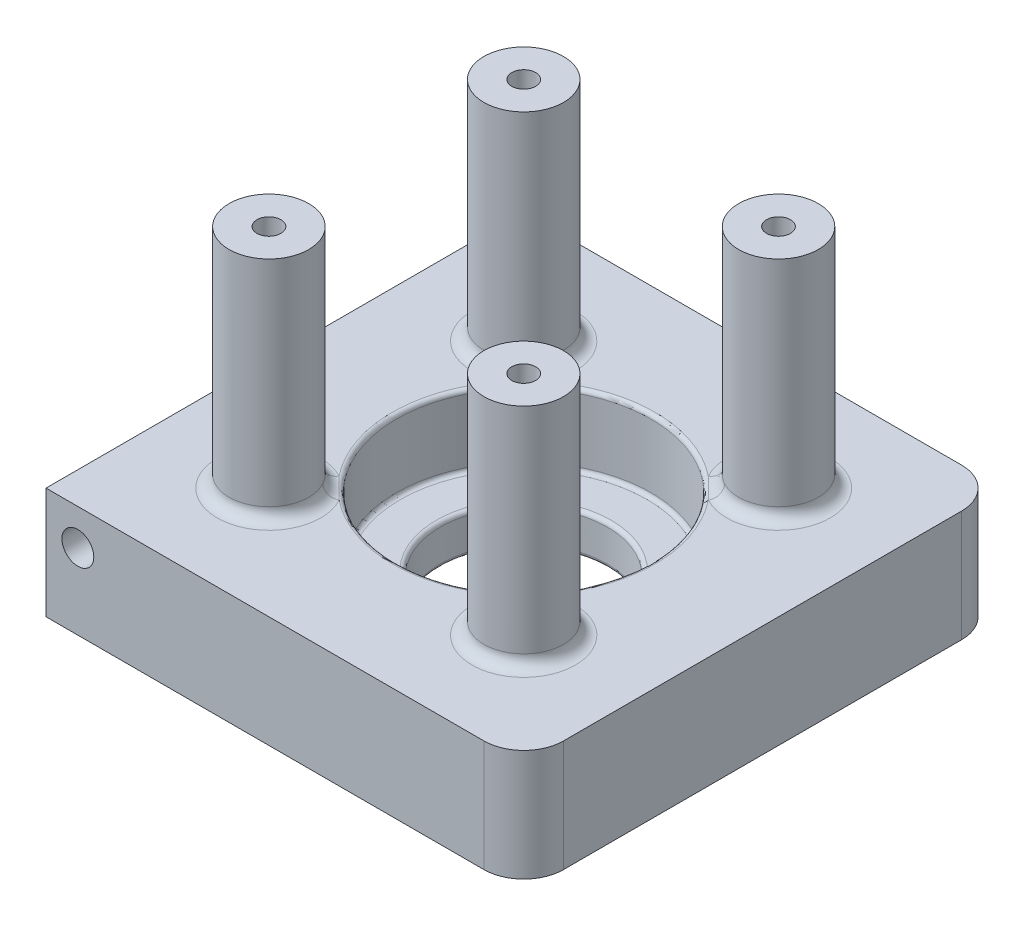
from build123d import *

# Parameters (mm, degrees)
SKETCH1_W           = 60
SKETCH1_H           = 60
BOSS_EXTRUDE1_DEPTH = 20
SKETCH2_R           = 7.5
CUT_EXTRUDE1_DEPTH  = 20
SKETCH3_R           = 16
CUT_EXTRUDE2_DEPTH  = 9
FILLET1_R           = 0.5
SKETCH4_W           = 50
SKETCH4_H           = 50
CUT_EXTRUDE3_DEPTH  = 6
SKETCH6_R           = 5
BOSS_EXTRUDE2_DEPTH = 28.45
SKETCH5_R           = 1.5
CUT_EXTRUDE5_DEPTH  = 54.45
SKETCH7_R           = 3
CUT_EXTRUDE6_DEPTH  = 3
FILLET2_R           = 1.5
SKETCH8_R           = 10.5
CUT_EXTRUDE7_DEPTH  = 9
FILLET3_R           = 0.5
SKETCH9_W           = 60
SKETCH9_H           = 60
SKETCH9_W_2         = 50
SKETCH9_H_2         = 50
CUT_EXTRUDE8_DEPTH  = 6
SKETCH10_R          = 2
CUT_EXTRUDE9_DEPTH  = 6
FILLET4_R           = 5
SKETCH11_R          = 2
CUT_EXTRUDE10_DEPTH = 14
CUT_EXTRUDE11_START = -14
SKETCH12_R          = 2
CUT_EXTRUDE11_DEPTH = 14


with BuildPart() as part:
    # Sketch1 → Boss-Extrude1 (new body)
    with BuildSketch(Plane(origin=(0, 0, 0), x_dir=(1, 0, 0), z_dir=(0, 1, 0))):
        Rectangle(SKETCH1_W, SKETCH1_H)
    extrude(amount=BOSS_EXTRUDE1_DEPTH)

    # Sketch2 → Cut-Extrude1 (cut)
    with BuildSketch(Plane(origin=(0, 20, 0), x_dir=(1, 0, 0), z_dir=(0, 1, 0))):
        with Locations(Location((0, 0, 0), (0, 0, 270))):
            Circle(SKETCH2_R)
    extrude(amount=-CUT_EXTRUDE1_DEPTH, mode=Mode.SUBTRACT)

    # Sketch3 → Cut-Extrude2 (cut)
    with BuildSketch(Plane(origin=(0, 20, 0), x_dir=(1, 0, 0), z_dir=(0, 1, 0))):
        with Locations(Location((0, 0, 0), (0, 0, 270))):
            Circle(SKETCH3_R)
    extrude(amount=-CUT_EXTRUDE2_DEPTH, mode=Mode.SUBTRACT)

    # Fillet1
    fillet1_edges = [part.edges().sort_by_distance(p)[0] for p in [
        (0, 0, -7.5),
        (0, 20, -16),
        (0, 11, -16),
        (0, 11, -7.5),
    ]]
    fillet(fillet1_edges, radius=FILLET1_R)

    # Sketch4 → Cut-Extrude3 (cut)
    with BuildSketch(Plane.XZ):
        Rectangle(SKETCH4_W, SKETCH4_H)
    extrude(amount=-CUT_EXTRUDE3_DEPTH, mode=Mode.SUBTRACT)

    # Sketch6 → Boss-Extrude2 (add)
    with BuildSketch(Plane(origin=(0, 20, 0), x_dir=(1, 0, 0), z_dir=(0, 1, 0))):
        with Locations(Location((-16, 16, 0), (0, 0, 270))):
            Circle(SKETCH6_R)
        with Locations(Location((16, 16, 0), (0, 0, 270))):
            Circle(SKETCH6_R)
        with Locations(Location((-16, -16, 0), (0, 0, 270))):
            Circle(SKETCH6_R)
        with Locations(Location((16, -16, 0), (0, 0, 270))):
            Circle(SKETCH6_R)
    extrude(amount=BOSS_EXTRUDE2_DEPTH)

    # Sketch5 → Cut-Extrude5 (cut)
    with BuildSketch(Plane.XZ.offset(-6)):
        with Locations(Location((-16, 16, 0), (0, 0, 270))):
            Circle(SKETCH5_R)
        with Locations(Location((-16, -16, 0), (0, 0, 270))):
            Circle(SKETCH5_R)
        with Locations(Location((16, -16, 0), (0, 0, 270))):
            Circle(SKETCH5_R)
        with Locations(Location((16, 16, 0), (0, 0, 270))):
            Circle(SKETCH5_R)
    extrude(amount=-CUT_EXTRUDE5_DEPTH, mode=Mode.SUBTRACT)

    # Sketch7 → Cut-Extrude6 (cut)
    with BuildSketch(Plane.XZ.offset(-6)):
        with Locations(Location((-16, 16, 0), (0, 0, 270))):
            Circle(SKETCH7_R)
        with Locations(Location((-16, -16, 0), (0, 0, 270))):
            Circle(SKETCH7_R)
        with Locations(Location((16, -16, 0), (0, 0, 270))):
            Circle(SKETCH7_R)
        with Locations(Location((16, 16, 0), (0, 0, 270))):
            Circle(SKETCH7_R)
    extrude(amount=-CUT_EXTRUDE6_DEPTH, mode=Mode.SUBTRACT)

    # Fillet2
    fillet2_edges = [part.edges().sort_by_distance(p)[0] for p in [
        (16, 20, -21),
        (-16, 20, 11),
        (16, 20, 11),
        (-16, 20, -21),
    ]]
    fillet(fillet2_edges, radius=FILLET2_R)

    # Sketch8 → Cut-Extrude7 (cut)
    with BuildSketch(Plane.XZ.offset(-6)):
        with Locations(Location((0, 0, 0), (0, 0, 270))):
            Circle(SKETCH8_R)
    extrude(amount=-CUT_EXTRUDE7_DEPTH, mode=Mode.SUBTRACT)

    # Fillet3
    fillet3_edges = [part.edges().sort_by_distance(p)[0] for p in [
        (0, 6, 10.5),
        (0, 11, 10.5),
    ]]
    fillet(fillet3_edges, radius=FILLET3_R)

    # Sketch9 → Cut-Extrude8 (cut)
    with BuildSketch(Plane.XZ):
        Rectangle(SKETCH9_W, SKETCH9_H)
        Rectangle(SKETCH9_W_2, SKETCH9_H_2, mode=Mode.SUBTRACT)
    extrude(amount=-CUT_EXTRUDE8_DEPTH, mode=Mode.SUBTRACT)

    # Sketch10 → Cut-Extrude9 (cut)
    with BuildSketch(Plane.XZ.offset(-6)):
        with Locations(Location((-25, 25, 0), (0, 0, 270))):
            Circle(SKETCH10_R)
        with Locations(Location((-25, -25, 0), (0, 0, 270))):
            Circle(SKETCH10_R)
        with Locations(Location((25, -25, 0), (0, 0, 270))):
            Circle(SKETCH10_R)
        with Locations(Location((25, 25, 0), (0, 0, 270))):
            Circle(SKETCH10_R)
    extrude(amount=-CUT_EXTRUDE9_DEPTH, mode=Mode.SUBTRACT)

    # Fillet4
    fillet4_edges = [part.edges().sort_by_distance(p)[0] for p in [
        (30, 13, -30),
        (30, 13, 30),
    ]]
    fillet(fillet4_edges, radius=FILLET4_R)

    # Sketch11 → Cut-Extrude10 (cut)
    with BuildSketch(Plane.XY.offset(30)):
        with Locations((-26, 15.496538957)):
            Circle(SKETCH11_R)
    extrude(amount=-CUT_EXTRUDE10_DEPTH, mode=Mode.SUBTRACT)

    # Sketch12 → Cut-Extrude11 (cut)
    with BuildSketch(Plane(origin=(0, 0, -30), x_dir=(-1, 0, 0), z_dir=(0, 0, -1)).offset(CUT_EXTRUDE11_START)):
        with Locations(Location((26, 15.496538957, 0), (0, 0, 180))):
            Circle(SKETCH12_R)
    extrude(amount=CUT_EXTRUDE11_DEPTH, mode=Mode.SUBTRACT)


solid = part.part
